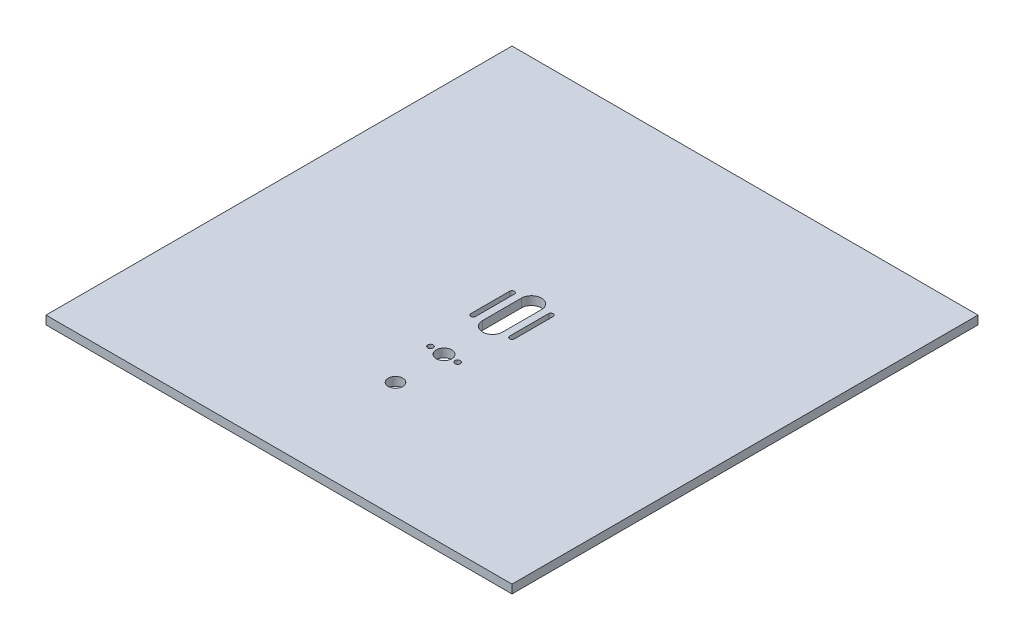
from build123d import *

# Parameters (mm, degrees)
SKETCH1_W           = 304.8
SKETCH1_H           = 304.8
BOSS_EXTRUDE1_DEPTH = 5.588
SKETCH2_R           = 4.7625
SKETCH2_R_2         = 5.08
SKETCH2_R_3         = 1.778
CUT_EXTRUDE1_DEPTH  = 216.598575468


with BuildPart() as part:
    # Sketch1 → Boss-Extrude1 (new body)
    with BuildSketch(Plane(origin=(0, 0, 0), x_dir=(1, 0, 0), z_dir=(0, 1, 0))):
        Rectangle(SKETCH1_W, SKETCH1_H)
    extrude(amount=BOSS_EXTRUDE1_DEPTH)

    # Sketch2 → Cut-Extrude1 (cut, through all)
    with BuildSketch(Plane(origin=(0, 5.588, 0), x_dir=(1, 0, 0), z_dir=(0, 1, 0))):
        with Locations(Location((0, -76.2, 0), (0, 0, 270))):
            Circle(SKETCH2_R)
        with Locations(Location((0, -44.45, 0), (0, 0, 270))):
            Circle(SKETCH2_R_2)
        with Locations(Location((-8.89, -44.45, 0), (0, 0, 270))):
            Circle(SKETCH2_R_3)
        with Locations(Location((8.89, -44.45, 0), (0, 0, 270))):
            Circle(SKETCH2_R_3)
        with BuildLine():
            Line((6.5405, 12.7), (6.5405, -12.7))
            ThreePointArc((6.5405, -12.7), (0, -19.2405), (-6.5405, -12.7))
            Line((-6.5405, -12.7), (-6.5405, 12.7))
            ThreePointArc((-6.5405, 12.7), (0, 19.2405), (6.5405, 12.7))
        make_face()
        with BuildLine():
            Line((-11.1125, 12.7), (-11.1125, -12.7))
            ThreePointArc((-11.1125, -12.7), (-12.7, -14.2875), (-14.2875, -12.7))
            Line((-14.2875, -12.7), (-14.2875, 12.7))
            ThreePointArc((-14.2875, 12.7), (-12.7, 14.2875), (-11.1125, 12.7))
        make_face()
        with BuildLine():
            Line((14.2875, 12.7), (14.2875, -12.7))
            ThreePointArc((14.2875, -12.7), (12.7, -14.2875), (11.1125, -12.7))
            Line((11.1125, -12.7), (11.1125, 12.7))
            ThreePointArc((11.1125, 12.7), (12.7, 14.2875), (14.2875, 12.7))
        make_face()
    extrude(amount=-CUT_EXTRUDE1_DEPTH, mode=Mode.SUBTRACT)


solid = part.part
